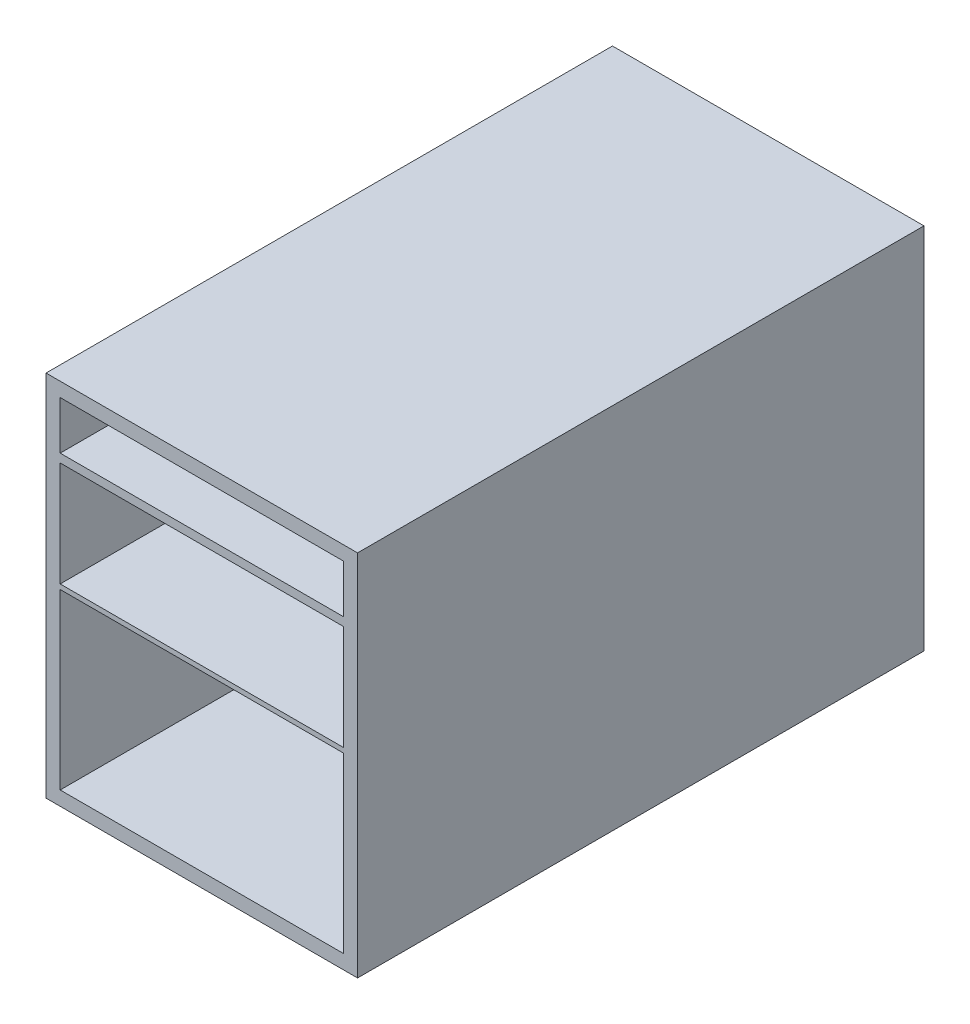
from build123d import *

# Parameters (mm, degrees)
SKETCH1_W           = 110
SKETCH1_H           = 130
BOSS_EXTRUDE1_DEPTH = 200
SHELL1_T            = -5
SKETCH2_W           = 110
SKETCH2_H           = 1.7
BOSS_EXTRUDE2_DEPTH = 200
SKETCH5_W           = 110
SKETCH5_H           = 3
BOSS_EXTRUDE3_DEPTH = 200


with BuildPart() as part:
    # Sketch1 → Boss-Extrude1 (new body)
    with BuildSketch(Plane.XY):
        Rectangle(SKETCH1_W, SKETCH1_H)
    extrude(amount=BOSS_EXTRUDE1_DEPTH)

    # Shell1
    shell1_openings = [part.faces().sort_by_distance(p)[0] for p in [
        (0, 0, 200),
    ]]
    offset(amount=SHELL1_T, openings=shell1_openings, kind=Kind.INTERSECTION)

    # Sketch2 → Boss-Extrude2 (add)
    with BuildSketch(Plane(origin=(0, 0, 0), x_dir=(-1, 0, 0), z_dir=(0, 0, -1))):
        with Locations((0, 2.15)):
            Rectangle(SKETCH2_W, SKETCH2_H)
    extrude(amount=-BOSS_EXTRUDE2_DEPTH)

    # Sketch5 → Boss-Extrude3 (add)
    with BuildSketch(Plane(origin=(0, 0, 0), x_dir=(-1, 0, 0), z_dir=(0, 0, -1))):
        with Locations((0, 41.5)):
            Rectangle(SKETCH5_W, SKETCH5_H)
    extrude(amount=-BOSS_EXTRUDE3_DEPTH)


solid = part.part
